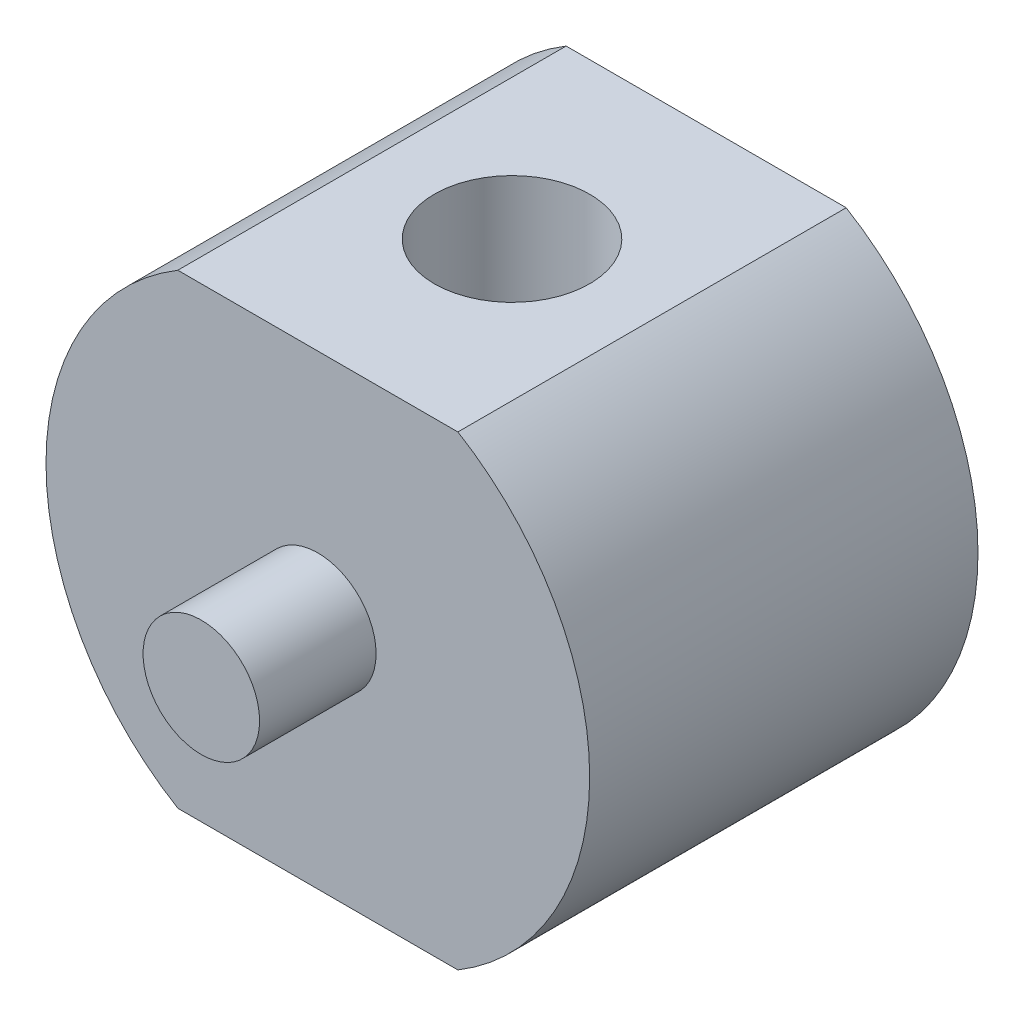
from build123d import *

# Parameters (mm, degrees)
BASE_EXTRUSION_DEPTH = 10
ESQUISSE2_R          = 1.5
BOSS_EXTRU_1_DEPTH   = 3
BOSS_EXTRU_2_START   = 3
ESQUISSE3_R          = 1.5
BOSS_EXTRU_2_DEPTH   = 3
PER_AGE1_D           = 4
PER_AGE1_DEPTH       = 11.99888719
PER_AGE1_TIP         = 1.201721238


with BuildPart() as part:
    # Esquisse1 → Base-Extrusion (new body)
    with BuildSketch(Plane.XY):
        with BuildLine():
            Line((-3.606477028, 5.999443595), (3.606477028, 5.999443595))
            ThreePointArc((3.606477028, 5.999443595), (7, 0), (3.606477028, -5.999443595))
            Line((3.606477028, -5.999443595), (-3.606477028, -5.999443595))
            ThreePointArc((-3.606477028, -5.999443595), (-7, 0), (-3.606477028, 5.999443595))
        make_face()
    extrude(amount=BASE_EXTRUSION_DEPTH)

    # Esquisse2 → Boss.-Extru.1 (add)
    with BuildSketch(Plane.XY.offset(10)):
        Circle(ESQUISSE2_R)
    extrude(amount=BOSS_EXTRU_1_DEPTH)

    # Esquisse3 → Boss.-Extru.2 (add)
    with BuildSketch(Plane(origin=(0, 0, 0), x_dir=(-1, 0, 0), z_dir=(0, 0, -1)).offset(BOSS_EXTRU_2_START)):
        with Locations(Location((0, 0, 0), (0, 0, 180))):
            Circle(ESQUISSE3_R)
    extrude(amount=-BOSS_EXTRU_2_DEPTH)

    # Perçage1
    with Locations(Plane(origin=(0, 5.999443595, 0), x_dir=(-1, 0, 0), z_dir=(0, 1, 0))):
        with Locations((0, 5)):
            Hole(PER_AGE1_D / 2, depth=PER_AGE1_DEPTH)
            with Locations((0, 0, -(PER_AGE1_DEPTH + PER_AGE1_TIP / 2))):  # 118° drill point
                Cone(0, PER_AGE1_D / 2, PER_AGE1_TIP, mode=Mode.SUBTRACT)


solid = part.part
